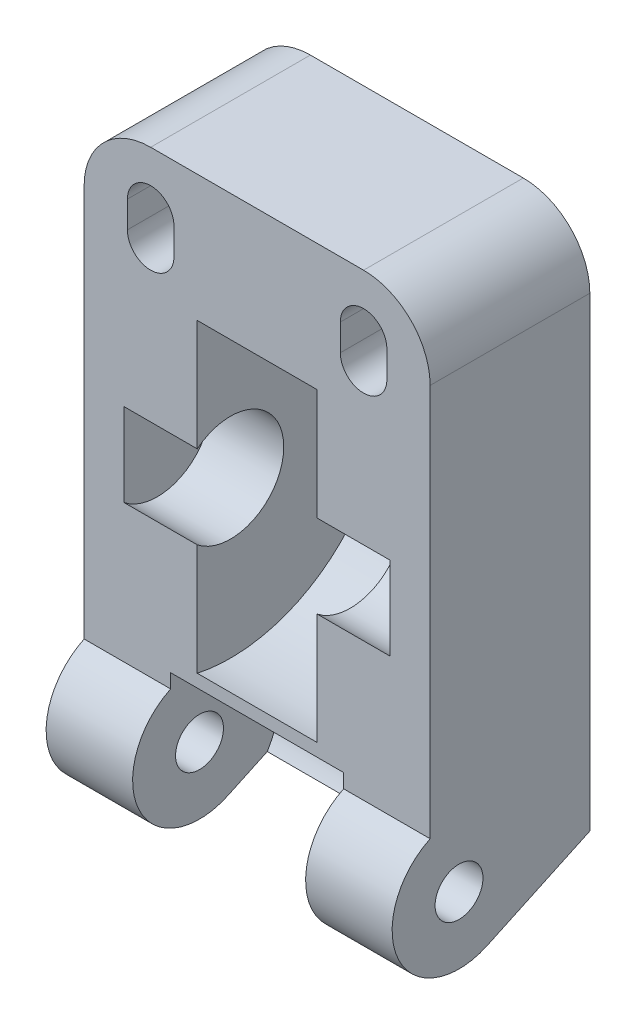
from build123d import *

# Parameters (mm, degrees)
SKETCH1_R           = 1.8
BOSS_EXTRUDE1_DEPTH = 13
SKETCH2_R           = 4
CUT_EXTRUDE1_DEPTH  = 10
SKETCH3_R           = 11.75
CUT_EXTRUDE2_DEPTH  = 4.5
SKETCH4_R           = 6
CUT_EXTRUDE3_DEPTH  = 6.5
CUT_EXTRUDE6_DEPTH  = 45.606330279
FILLET1_R           = 5


with BuildPart() as part:
    # Sketch1 → Boss-Extrude1 (new, symmetric)
    with BuildSketch(Plane(origin=(0, 0, 0), x_dir=(0, 0, -1), z_dir=(1, 0, 0))):
        with BuildLine():
            Line((0, 0), (0, 40))
            Line((0, 40), (-12, 40))
            Line((-12, 40), (-12, 5.5))
            ThreePointArc((-12, 5.5), (-14.374806505, -1.183390223), (-7.70361619, -3.592255225))
            Line((-7.70361619, -3.592255225), (0, 0))
        make_face()
        with Locations(Location((-9.828619755, 0.964829626, 0), (0, 0, 180))):
            Circle(SKETCH1_R, mode=Mode.SUBTRACT)
    extrude(amount=BOSS_EXTRUDE1_DEPTH, both=True)

    # Sketch2 → Cut-Extrude1 (cut, symmetric)
    with BuildSketch(Plane(origin=(0, 0, 0), x_dir=(0, 0, -1), z_dir=(1, 0, 0))):
        with Locations((-9.5, 19)):
            Circle(SKETCH2_R)
    extrude(amount=CUT_EXTRUDE1_DEPTH, both=True, mode=Mode.SUBTRACT)

    # Sketch3 → Cut-Extrude2 (cut, symmetric)
    with BuildSketch(Plane(origin=(0, 0, 0), x_dir=(0, 0, -1), z_dir=(1, 0, 0))):
        with Locations((-9.5, 19)):
            Circle(SKETCH3_R)
    extrude(amount=CUT_EXTRUDE2_DEPTH, both=True, mode=Mode.SUBTRACT)

    # Sketch4 → Cut-Extrude3 (cut, symmetric)
    with BuildSketch(Plane(origin=(0, 0, 0), x_dir=(0, 0, -1), z_dir=(1, 0, 0))):
        with Locations((-9.828619755, 0.964829626)):
            Circle(SKETCH4_R)
    extrude(amount=CUT_EXTRUDE3_DEPTH, both=True, mode=Mode.SUBTRACT)

    # Sketch7 → Cut-Extrude6 (cut, through all)
    with BuildSketch(Plane(origin=(0, 0, 0), x_dir=(-1, 0, 0), z_dir=(0, 0, -1))):
        with BuildLine():
            Line((-6.25, 35.75), (-6.25, 33.75))
            ThreePointArc((-6.25, 33.75), (-8, 32), (-9.75, 33.75))
            Line((-9.75, 33.75), (-9.75, 35.75))
            ThreePointArc((-9.75, 35.75), (-8, 37.5), (-6.25, 35.75))
        make_face()
        with BuildLine():
            Line((9.75, 35.75), (9.75, 33.75))
            ThreePointArc((9.75, 33.75), (8, 32), (6.25, 33.75))
            Line((6.25, 33.75), (6.25, 35.75))
            ThreePointArc((6.25, 35.75), (8, 37.5), (9.75, 35.75))
        make_face()
    extrude(amount=-CUT_EXTRUDE6_DEPTH, mode=Mode.SUBTRACT)

    # Fillet1
    fillet1_edges = [part.edges().sort_by_distance(p)[0] for p in [
        (13, 40, 6),
        (-13, 40, 6),
    ]]
    fillet(fillet1_edges, radius=FILLET1_R)


solid = part.part
